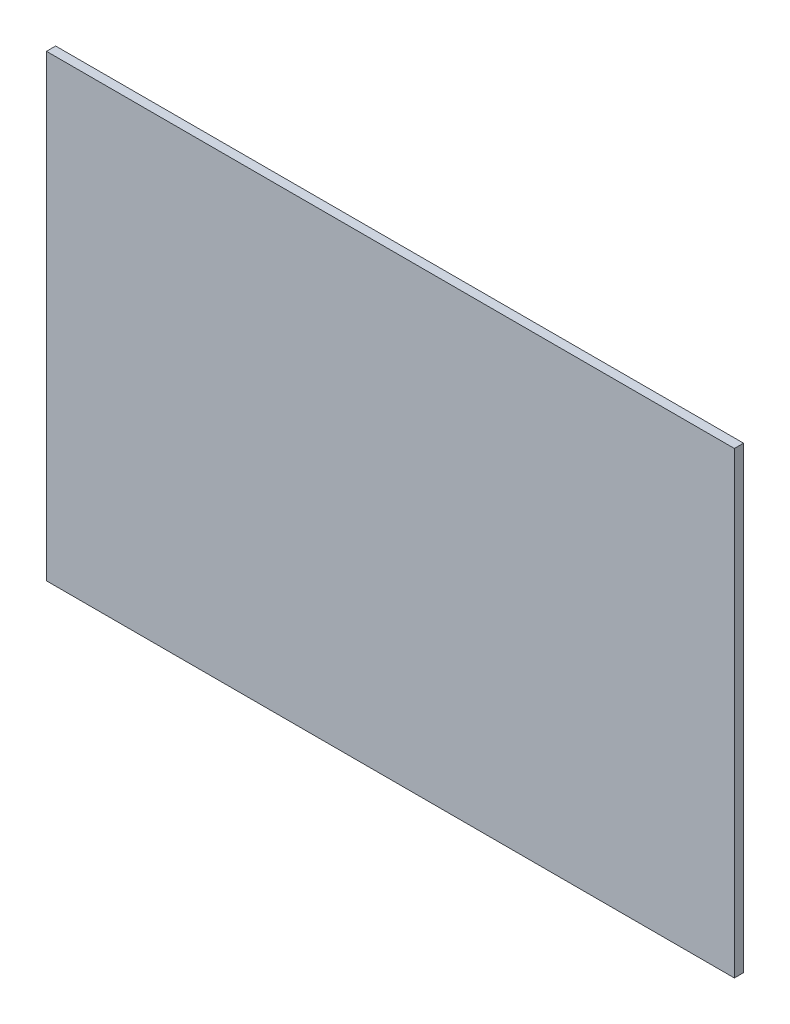
from build123d import *

# Parameters (mm, degrees)
SKETCH1_W           = 600
SKETCH1_H           = 400
BOSS_EXTRUDE1_DEPTH = 8


with BuildPart() as part:
    # Sketch1 → Boss-Extrude1 (new body)
    with BuildSketch(Plane.XY):
        with Locations((0, -17.891373802)):
            Rectangle(SKETCH1_W, SKETCH1_H)
    extrude(amount=BOSS_EXTRUDE1_DEPTH)


solid = part.part
